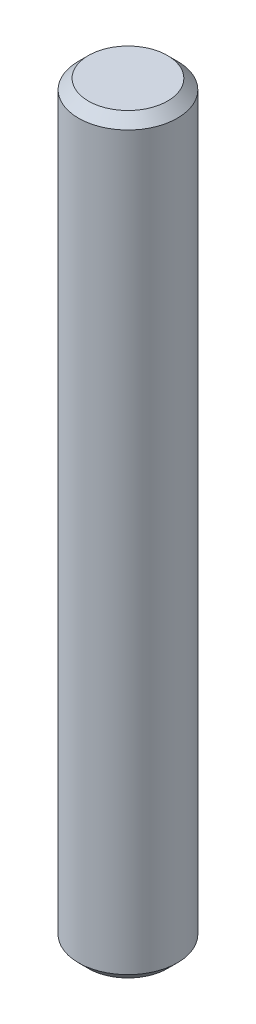
from build123d import *

# Parameters (mm, degrees)
SKETCH1_R           = 5
BOSS_EXTRUDE1_DEPTH = 38
CHAMFER1_SIZE       = 1


with BuildPart() as part:
    # Sketch1 → Boss-Extrude1 (new, symmetric)
    with BuildSketch(Plane(origin=(0, 0, 0), x_dir=(1, 0, 0), z_dir=(0, 1, 0))):
        with Locations(Location((0, 0, 0), (0, 0, 270))):
            Circle(SKETCH1_R)
    extrude(amount=BOSS_EXTRUDE1_DEPTH, both=True)

    # Chamfer1
    chamfer1_edges = [part.edges().sort_by_distance(p)[0] for p in [
        (0, -38, -5),
        (0, 38, -5),
    ]]
    chamfer(chamfer1_edges, length=CHAMFER1_SIZE)


solid = part.part
